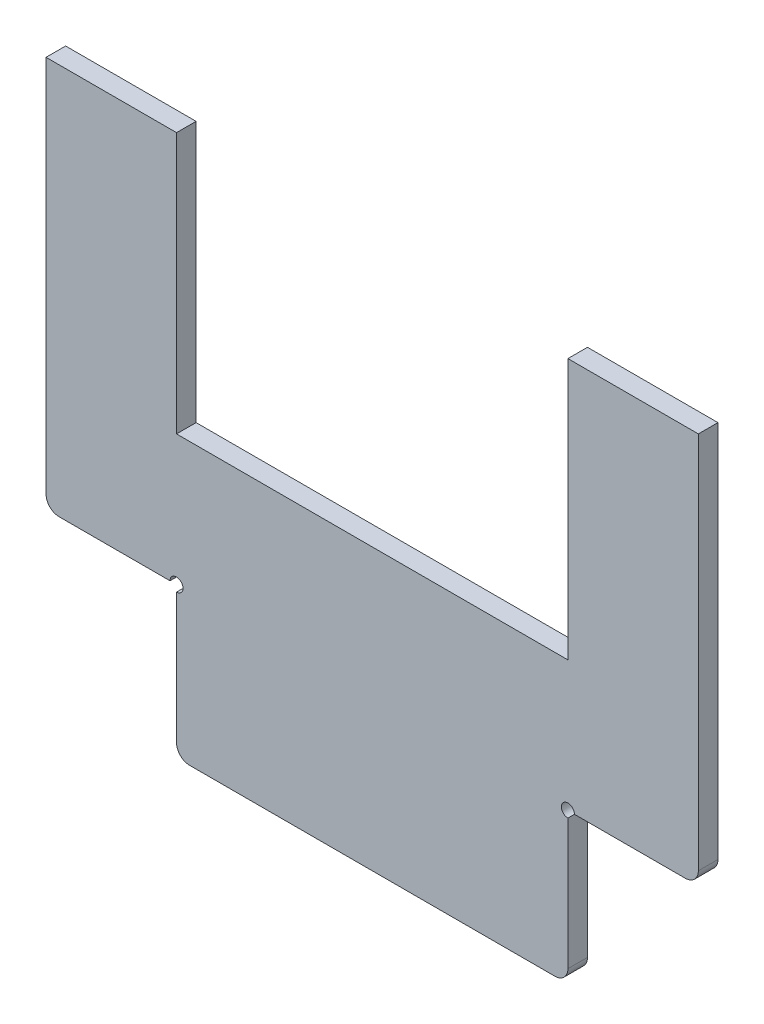
from build123d import *

# Parameters (mm, degrees)
SKETCH1_W           = 60
SKETCH1_H           = 23
BOSS_EXTRUDE1_DEPTH = 3
BOSS_EXTRUDE2_DEPTH = 3
SKETCH3_R           = 1
CUT_EXTRUDE1_DEPTH  = 88.299770905
FILLET1_R           = 2


with BuildPart() as part:
    # Sketch1 → Boss-Extrude1 (new body)
    with BuildSketch(Plane.XY):
        Rectangle(SKETCH1_W, SKETCH1_H)
    extrude(amount=BOSS_EXTRUDE1_DEPTH)

    # Sketch2 → Boss-Extrude2 (add)
    with BuildSketch(Plane.XY.offset(3)):
        Polygon((50, 11.5), (-50, 11.5), (-50, 71.5), (-30, 71.5), (-30, 31.5), (30, 31.5), (30, 71.5), (50, 71.5), align=None)
    extrude(amount=-BOSS_EXTRUDE2_DEPTH)

    # Sketch3 → Cut-Extrude1 (cut, through all)
    with BuildSketch(Plane.XY.offset(3)):
        with Locations((-30, 11.5)):
            Circle(SKETCH3_R)
        with Locations((30, 11.5)):
            Circle(SKETCH3_R)
    extrude(amount=-CUT_EXTRUDE1_DEPTH, mode=Mode.SUBTRACT)

    # Fillet1
    fillet1_edges = [part.edges().sort_by_distance(p)[0] for p in [
        (50, 11.5, 1.5),
        (-50, 11.5, 1.5),
        (30, -11.5, 1.5),
        (-30, -11.5, 1.5),
    ]]
    fillet(fillet1_edges, radius=FILLET1_R)


solid = part.part
